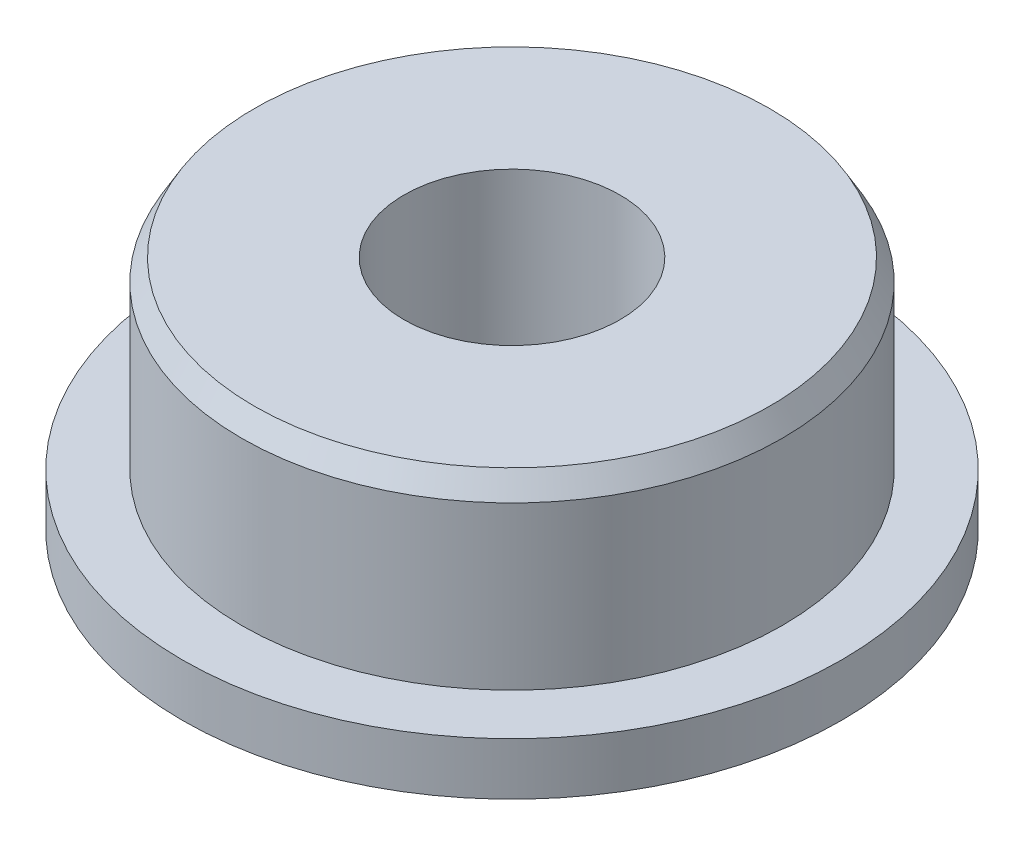
from build123d import *
from OCP.BRepFilletAPI import BRepFilletAPI_MakeChamfer

# Parameters (mm, degrees)
SKETCH_1_R      = 2.5
SKETCH_1_R_2    = 1
EXTRUDE_1_DEPTH = 2.3
SKETCH_1_3_R    = 3.05
SKETCH_1_3_R_2  = 2.5
EXTRUDE_2_DEPTH = 0.6
CHAMFER_1_SIZE  = 0.2
CHAMFER_1_SIZE2 = 0.115470054


with BuildPart() as part:
    # 草图1 → 凸台-拉伸1 (new body)
    with BuildSketch(Plane(origin=(0, 0, 0), x_dir=(1, 0, 0), z_dir=(0, 1, 0))):
        Circle(SKETCH_1_R)
        Circle(SKETCH_1_R_2, mode=Mode.SUBTRACT)
    extrude(amount=EXTRUDE_1_DEPTH)

    # 草图1<3> → 凸台-拉伸2 (add)
    with BuildSketch(Plane(origin=(0, 0, 0), x_dir=(1, 0, 0), z_dir=(0, 1, 0))):
        Circle(SKETCH_1_3_R)
        Circle(SKETCH_1_3_R_2, mode=Mode.SUBTRACT)
    extrude(amount=EXTRUDE_2_DEPTH)

    # 倒角1: one chamfer whose edges measure the first distance from different faces: ONE call of the kernel's chamfer builder (chamfer() names one face for all edges)
    chamfer_1_edges_1 = [part.edges().sort_by_distance(p)[0] for p in [
        (-2.5, 2.3, 0),
    ]]
    chamfer_1_side_1 = [part.faces().sort_by_distance(p)[0] for p in [
        (-2.5, 1.45, 0),
    ]]
    chamfer_1_edges_2 = [part.edges().sort_by_distance(p)[0] for p in [
        (-3.05, 0, 0),
    ]]
    chamfer_1_side_2 = [part.faces().sort_by_distance(p)[0] for p in [
        (-2.963732973, 0, 0),
    ]]
    chamfer_1 = BRepFilletAPI_MakeChamfer(part.part.solid().wrapped)
    for e in chamfer_1_edges_1:
        chamfer_1.Add(CHAMFER_1_SIZE, CHAMFER_1_SIZE2, e.wrapped, chamfer_1_side_1[0].wrapped)  # the first distance lies on this face
    for e in chamfer_1_edges_2:
        chamfer_1.Add(CHAMFER_1_SIZE, CHAMFER_1_SIZE2, e.wrapped, chamfer_1_side_2[0].wrapped)  # the first distance lies on this face
    add(Compound.cast(chamfer_1.Shape()), mode=Mode.REPLACE)


solid = part.part
